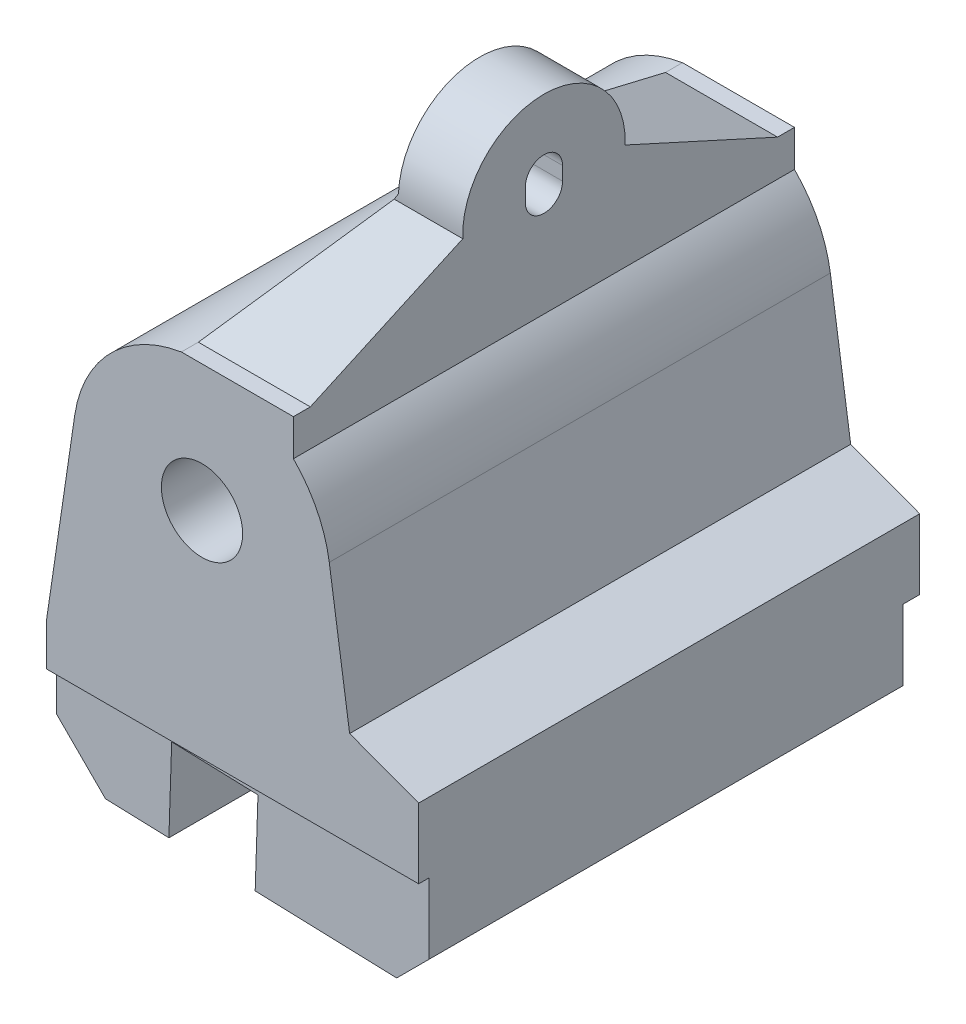
from build123d import *

# Parameters (mm, degrees)
EXTRUDE_1_DEPTH                  = 296
CUT_EXTRUDE_1_REACH              = 375.122
SKETCH_2_R                       = 24
EXTRUDE_START                    = -296
EXTRUDE_2_DEPTH                  = 296
CUT_EXTRUDE_2_REACH              = 369.94
CUT_EXTRUDE_2_DIRECTION_2_REACH  = 369.94
SKETCH_5_R                       = 38
CUT_EXTRUDE_4_DEPTH              = 16
CUT_EXTRUDE_4_DIRECTION_2_REACH  = 369.94
CUT_EXTRUDE_10_REACH             = 369.94
CUT_EXTRUDE_11_REACH             = 369.94
CUT_EXTRUDE_12_REACH             = 369.94
CUT_EXTRUDE_12_DIRECTION_2_REACH = 369.94
CUT_EXTRUDE_1_2_DEPTH            = 374.122168517
CUT_EXTRUDE_1_2_DEPTH_BACK       = 6
SKETCH_10_W                      = 353.554121084
SKETCH_10_H                      = 70
CUT_EXTRUDE_2_2_DEPTH            = 374.122168517
CUT_EXTRUDE_2_2_DEPTH_BACK       = 10
SKETCH_11_W                      = 315.319296241
SKETCH_11_H                      = 70
CUT_EXTRUDE_13_DEPTH             = 49.976974814


with BuildPart() as part:
    # 草图1 → 凸台-拉伸1 (new body)
    with BuildSketch(Plane.XY):
        with BuildLine():
            Line((-75.187918949, 11.080471294), (-92, -103))
            Line((-92, -103), (-92, -153))
            Line((-92, -153), (-63, -182))
            Line((-63, -182), (-25.55454992, -183.234465387))
            Line((-25.55454992, -183.234465387), (-23.907851937, -133.284626575))
            Line((-23.907851937, -133.284626575), (27.064456588, -134.965032351))
            Line((27.064456588, -134.965032351), (25.417758605, -184.914871163))
            Line((25.417758605, -184.914871163), (109, -187.67032967))
            Line((109, -187.67032967), (128, -168.67032967))
            Line((128, -168.67032967), (128, -85.67032967))
            Line((128, -85.67032967), (87.212696765, -70.515157246))
            Line((87.212696765, -70.515157246), (75.187918949, 11.080471294))
            ThreePointArc((75.187918949, 11.080471294), (0, 76), (-75.187918949, 11.080471294))
        make_face()
    extrude(amount=EXTRUDE_1_DEPTH)

    # 草图2 → Cut-Extrude 1 (cut, up to next)
    with BuildSketch(Plane.XY.offset(296), mode=Mode.PRIVATE) as cut_extrude_1_sk1:
        Circle(SKETCH_2_R)
    cut_extrude_1_tool1 = extrude(cut_extrude_1_sk1.sketch, amount=-CUT_EXTRUDE_1_REACH, mode=Mode.PRIVATE) & part.part
    add(cut_extrude_1_tool1.solids().sort_by_distance((0, 0, 296))[0], mode=Mode.SUBTRACT)

    # 草图3 → 凸台-拉伸2 (add)
    with BuildSketch(Plane.XY.offset(296).offset(EXTRUDE_START)):
        with BuildLine():
            Line((54, 53.478967828), (54, 166))
            Line((54, 166), (16, 166))
            Line((16, 166), (16, 120))
            Line((16, 120), (-12.175135195, 75.018438287))
            ThreePointArc((-12.175135195, 75.018438287), (23.522691723, 72.268132494), (54, 53.478967828))
        make_face()
    extrude(amount=EXTRUDE_2_DEPTH)

    # 草图4 → Cut-Extrude 2 (cut, up to next)
    with BuildSketch(Plane.ZY.offset(-16), mode=Mode.PRIVATE) as cut_extrude_2_sk1:
        with BuildLine():
            Line((159, 124), (159, 116))
            ThreePointArc((159, 116), (148, 105), (137, 116))
            Line((137, 116), (137, 124))
            ThreePointArc((137, 124), (148, 135), (159, 124))
        make_face()
    cut_extrude_2_tool1 = extrude(cut_extrude_2_sk1.sketch, amount=-CUT_EXTRUDE_2_REACH, mode=Mode.PRIVATE) & part.part
    add(cut_extrude_2_tool1.solids().sort_by_distance((16, 120, 148))[0], mode=Mode.SUBTRACT)

    # 草图4 → Cut-Extrude 2 direction 2 (cut, up to next)
    with BuildSketch(Plane.ZY.offset(-16), mode=Mode.PRIVATE) as cut_extrude_2_direction_2_sk1:
        with BuildLine():
            Line((159, 124), (159, 116))
            ThreePointArc((159, 116), (148, 105), (137, 116))
            Line((137, 116), (137, 124))
            ThreePointArc((137, 124), (148, 135), (159, 124))
        make_face()
    cut_extrude_2_direction_2_tool1 = extrude(cut_extrude_2_direction_2_sk1.sketch, amount=CUT_EXTRUDE_2_DIRECTION_2_REACH, mode=Mode.PRIVATE) & part.part
    add(cut_extrude_2_direction_2_tool1.solids().sort_by_distance((16, 120, 148))[0], mode=Mode.SUBTRACT)

    # 草图5 → 切除-拉伸4 (cut)
    with BuildSketch(Plane.ZY.offset(-16)):
        with Locations((148, 120)):
            Circle(SKETCH_5_R)
    extrude(amount=-CUT_EXTRUDE_4_DEPTH, mode=Mode.SUBTRACT)

    # 草图5 → 切除-拉伸4 direction 2 (cut, up to next)
    with BuildSketch(Plane.ZY.offset(-16), mode=Mode.PRIVATE) as cut_extrude_4_direction_2_sk1:
        with Locations((148, 120)):
            Circle(SKETCH_5_R)
    cut_extrude_4_direction_2_tool1 = extrude(cut_extrude_4_direction_2_sk1.sketch, amount=CUT_EXTRUDE_4_DIRECTION_2_REACH, mode=Mode.PRIVATE) & part.part
    add(cut_extrude_4_direction_2_tool1.solids().sort_by_distance((16, 120, 148))[0], mode=Mode.SUBTRACT)

    # 草图6 → 切除-拉伸10 (cut, up to next)
    with BuildSketch(Plane.ZY.offset(-16), mode=Mode.PRIVATE) as cut_extrude_10_sk1:
        with BuildLine():
            Line((195.958315233, 120), (296, 120))
            Line((296, 120), (296, 166))
            Line((296, 166), (148, 166))
            ThreePointArc((148, 166), (181.226495452, 152.641016151), (195.958315233, 120))
        make_face()
    cut_extrude_10_tool1 = extrude(cut_extrude_10_sk1.sketch, amount=-CUT_EXTRUDE_10_REACH, mode=Mode.PRIVATE) & part.part
    add(cut_extrude_10_tool1.solids().sort_by_distance((16, 144.191812, 240.106882))[0], mode=Mode.SUBTRACT)

    # 草图6<5> → 切除-拉伸11 (cut, up to next)
    with BuildSketch(Plane.ZY.offset(-16), mode=Mode.PRIVATE) as cut_extrude_11_sk1:
        with BuildLine():
            ThreePointArc((100.041684767, 120), (114.773504548, 152.641016151), (148, 166))
            Line((148, 166), (0, 166))
            Line((0, 166), (0, 120))
            Line((0, 120), (100.041684767, 120))
        make_face()
    cut_extrude_11_tool1 = extrude(cut_extrude_11_sk1.sketch, amount=-CUT_EXTRUDE_11_REACH, mode=Mode.PRIVATE) & part.part
    add(cut_extrude_11_tool1.solids().sort_by_distance((16, 144.191812, 55.893118))[0], mode=Mode.SUBTRACT)

    # 草图6<6> → 切除-拉伸12 (cut, up to next)
    with BuildSketch(Plane.ZY.offset(-16), mode=Mode.PRIVATE) as cut_extrude_12_sk1:
        with BuildLine():
            ThreePointArc((100.041684767, 116), (100, 118), (100.041684767, 120))
            Line((100.041684767, 120), (0, 120))
            Line((0, 120), (0, 75.018438287))
            Line((0, 75.018438287), (10, 75.018438287))
            Line((10, 75.018438287), (100.041684767, 116))
        make_face()
    cut_extrude_12_tool1 = extrude(cut_extrude_12_sk1.sketch, amount=-CUT_EXTRUDE_12_REACH, mode=Mode.PRIVATE) & part.part
    # 草图6<6> → 切除-拉伸12 (cut, up to next)
    with BuildSketch(Plane.ZY.offset(-16), mode=Mode.PRIVATE) as cut_extrude_12_sk2:
        with BuildLine():
            Line((286, 75.018438287), (296, 75.018438287))
            Line((296, 75.018438287), (296, 120))
            Line((296, 120), (195.958315233, 120))
            ThreePointArc((195.958315233, 120), (196, 118), (195.958315233, 116))
            Line((195.958315233, 116), (286, 75.018438287))
        make_face()
    cut_extrude_12_tool2 = extrude(cut_extrude_12_sk2.sketch, amount=-CUT_EXTRUDE_12_REACH, mode=Mode.PRIVATE) & part.part
    add(cut_extrude_12_tool1.solids().sort_by_distance((16, 103.644966, 36.114885))[0], mode=Mode.SUBTRACT)
    add(cut_extrude_12_tool2.solids().sort_by_distance((16, 103.644966, 259.885115))[0], mode=Mode.SUBTRACT)

    # 草图6<6> → 切除-拉伸12 direction 2 (cut, up to next)
    with BuildSketch(Plane.ZY.offset(-16), mode=Mode.PRIVATE) as cut_extrude_12_direction_2_sk1:
        with BuildLine():
            ThreePointArc((100.041684767, 116), (100, 118), (100.041684767, 120))
            Line((100.041684767, 120), (0, 120))
            Line((0, 120), (0, 75.018438287))
            Line((0, 75.018438287), (10, 75.018438287))
            Line((10, 75.018438287), (100.041684767, 116))
        make_face()
    cut_extrude_12_direction_2_tool1 = extrude(cut_extrude_12_direction_2_sk1.sketch, amount=CUT_EXTRUDE_12_DIRECTION_2_REACH, mode=Mode.PRIVATE) & part.part
    # 草图6<6> → 切除-拉伸12 direction 2 (cut, up to next)
    with BuildSketch(Plane.ZY.offset(-16), mode=Mode.PRIVATE) as cut_extrude_12_direction_2_sk2:
        with BuildLine():
            Line((286, 75.018438287), (296, 75.018438287))
            Line((296, 75.018438287), (296, 120))
            Line((296, 120), (195.958315233, 120))
            ThreePointArc((195.958315233, 120), (196, 118), (195.958315233, 116))
            Line((195.958315233, 116), (286, 75.018438287))
        make_face()
    cut_extrude_12_direction_2_tool2 = extrude(cut_extrude_12_direction_2_sk2.sketch, amount=CUT_EXTRUDE_12_DIRECTION_2_REACH, mode=Mode.PRIVATE) & part.part
    add(cut_extrude_12_direction_2_tool1.solids().sort_by_distance((16, 103.644966, 36.114885))[0], mode=Mode.SUBTRACT)
    add(cut_extrude_12_direction_2_tool2.solids().sort_by_distance((16, 103.644966, 259.885115))[0], mode=Mode.SUBTRACT)

    # 草图10 → Cut-Extrude 1 2 (cut, two sides: drawn at the far end of the back side and taken through both)
    with BuildSketch(Plane.XY.offset(296).offset(-CUT_EXTRUDE_1_2_DEPTH_BACK)):
        with Locations((35.701307798, -162)):
            Rectangle(SKETCH_10_W, SKETCH_10_H)
    extrude(amount=CUT_EXTRUDE_1_2_DEPTH + CUT_EXTRUDE_1_2_DEPTH_BACK, mode=Mode.SUBTRACT)

    # 草图11 → Cut-Extrude 2 2 (cut, two sides: drawn at the far end of the back side and taken through both)
    with BuildSketch(Plane(origin=(0, 0, 0), x_dir=(-1, 0, 0), z_dir=(0, 0, -1)).offset(-CUT_EXTRUDE_2_2_DEPTH_BACK)):
        with Locations((-8.559302508, -162)):
            Rectangle(SKETCH_11_W, SKETCH_11_H)
    extrude(amount=CUT_EXTRUDE_2_2_DEPTH + CUT_EXTRUDE_2_2_DEPTH_BACK, mode=Mode.SUBTRACT)

    # 草图12 → 切除-拉伸13 (cut)
    with BuildSketch(Plane(origin=(-6.061881785, -183.87708082, 0), x_dir=(0.9994570299138168, -0.032949132854323, 0), z_dir=(-0.032949132854323, -0.9994570299138168, 0))):
        with BuildLine():
            Line((31.496742179, 262.5), (87.843649763, 79.657100204))
            ThreePointArc((87.843649763, 79.657100204), (70.653842384, 47.153092416), (38.149834596, 64.342899796))
            Line((38.149834596, 64.342899796), (31.496742179, 85.931852273))
            Line((31.496742179, 85.931852273), (31.496742179, 262.5))
        make_face()
    extrude(amount=-CUT_EXTRUDE_13_DEPTH, mode=Mode.SUBTRACT)


solid = part.part
